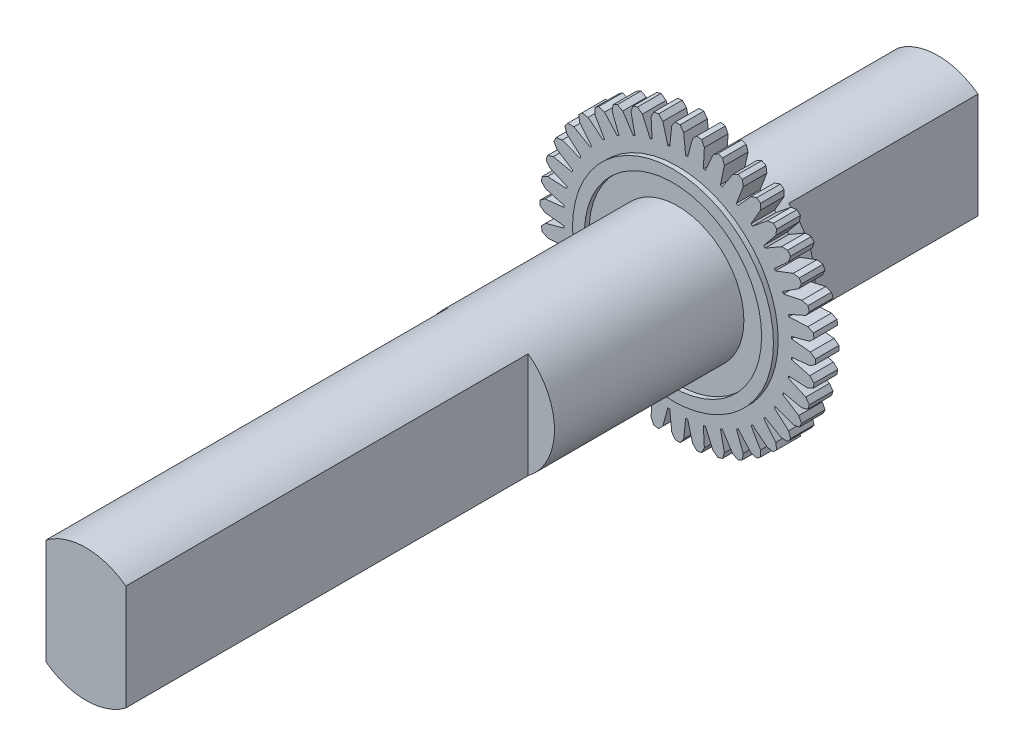
from build123d import *

# Parameters (mm, degrees)
BOSS_EXTRUDE1_DEPTH = 1
SKETCH2_R           = 4.245
SKETCH2_R_2         = 3.745
BOSS_EXTRUDE2_DEPTH = 0.2
SKETCH3_R           = 2.795
BOSS_EXTRUDE3_DEPTH = 25
BOSS_EXTRUDE4_START = 2
SKETCH4_R           = 2.795
BOSS_EXTRUDE4_DEPTH = 2
CUT_EXTRUDE2_DEPTH  = 17
BOSS_EXTRUDE5_START = 8
BOSS_EXTRUDE5_DEPTH = 8


with BuildPart() as part:
    # Sketch1 → Boss-Extrude1 (new body)
    with BuildSketch(Plane.XY):
        with BuildLine():
            Line((1.009764153, 5.726657084), (1.125066167, 5.495777362))
            Line((1.125066167, 5.495777362), (1.083139327, 4.691591862))
            ThreePointArc((1.083139327, 4.691591862), (1.124039427, 4.681961167), (1.164853927, 4.671973922))
            Line((1.164853927, 4.671973922), (1.492589417, 5.407542837))
            Line((1.492589417, 5.407542837), (1.700141463, 5.560912156))
            ThreePointArc((1.700141463, 5.560912156), (1.796933822, 5.530393642), (1.893178818, 5.498190517))
            Line((1.893178818, 5.498190517), (1.970943727, 5.2521161))
            Line((1.970943727, 5.2521161), (1.803730747, 4.46439026))
            ThreePointArc((1.803730747, 4.46439026), (1.842620727, 4.448479949), (1.881370384, 4.432230869))
            Line((1.881370384, 4.432230869), (2.320139235, 5.107474584))
            Line((2.320139235, 5.107474584), (2.549128219, 5.226487379))
            ThreePointArc((2.549128219, 5.226487379), (2.639954756, 5.181202938), (2.729977138, 5.134340252))
            Line((2.729977138, 5.134340252), (2.768290111, 4.879130307))
            Line((2.768290111, 4.879130307), (2.479908331, 4.127260553))
            ThreePointArc((2.479908331, 4.127260553), (2.515830589, 4.105462391), (2.551561257, 4.083351583))
            Line((2.551561257, 4.083351583), (3.090559525, 4.681643357))
            Line((3.090559525, 4.681643357), (3.335346977, 4.763369138))
            ThreePointArc((3.335346977, 4.763369138), (3.417971242, 4.704433822), (3.49955436, 4.644065491))
            Line((3.49955436, 4.644065491), (3.497472006, 4.386004134))
            Line((3.497472006, 4.386004134), (3.095022341, 3.688503994))
            ThreePointArc((3.095022341, 3.688503994), (3.127092353, 3.661354724), (3.158924225, 3.633926629))
            Line((3.158924225, 3.633926629), (3.784879983, 4.140534532))
            Line((3.784879983, 4.140534532), (4.039438424, 4.182960939))
            ThreePointArc((4.039438424, 4.182960939), (4.111825933, 4.111825933), (4.182960939, 4.039438424))
            Line((4.182960939, 4.039438424), (4.140534532, 3.784879983))
            Line((4.140534532, 3.784879983), (3.633926629, 3.158924225))
            ThreePointArc((3.633926629, 3.158924225), (3.661354724, 3.127092353), (3.688503994, 3.095022341))
            Line((3.688503994, 3.095022341), (4.386004134, 3.497472006))
            Line((4.386004134, 3.497472006), (4.644065491, 3.49955436))
            ThreePointArc((4.644065491, 3.49955436), (4.704433822, 3.417971242), (4.763369138, 3.335346977))
            Line((4.763369138, 3.335346977), (4.681643357, 3.090559525))
            Line((4.681643357, 3.090559525), (4.083351583, 2.551561257))
            ThreePointArc((4.083351583, 2.551561257), (4.105462391, 2.515830589), (4.127260553, 2.479908331))
            Line((4.127260553, 2.479908331), (4.879130307, 2.768290111))
            Line((4.879130307, 2.768290111), (5.134340252, 2.729977138))
            ThreePointArc((5.134340252, 2.729977138), (5.181202938, 2.639954756), (5.226487379, 2.549128219))
            Line((5.226487379, 2.549128219), (5.107474584, 2.320139235))
            Line((5.107474584, 2.320139235), (4.432230869, 1.881370384))
            ThreePointArc((4.432230869, 1.881370384), (4.448479949, 1.842620727), (4.46439026, 1.803730747))
            Line((4.46439026, 1.803730747), (5.2521161, 1.970943727))
            Line((5.2521161, 1.970943727), (5.498190517, 1.893178818))
            ThreePointArc((5.498190517, 1.893178818), (5.530393642, 1.796933822), (5.560912156, 1.700141463))
            Line((5.560912156, 1.700141463), (5.407542837, 1.492589417))
            Line((5.407542837, 1.492589417), (4.671973922, 1.164853927))
            ThreePointArc((4.671973922, 1.164853927), (4.681961167, 1.124039427), (4.691591862, 1.083139327))
            Line((4.691591862, 1.083139327), (5.495777362, 1.125066167))
            Line((5.495777362, 1.125066167), (5.726657084, 1.009764153))
            ThreePointArc((5.726657084, 1.009764153), (5.743407701, 0.909666414), (5.75840882, 0.809291582))
            Line((5.75840882, 0.809291582), (5.574459438, 0.628287093))
            Line((5.574459438, 0.628287093), (4.796677471, 0.419654901))
            ThreePointArc((4.796677471, 0.419654901), (4.800156962, 0.377780546), (4.803270902, 0.335877421))
            Line((4.803270902, 0.335877421), (5.604114347, 0.251485743))
            Line((5.604114347, 0.251485743), (5.814114347, 0.101485743))
            ThreePointArc((5.814114347, 0.101485743), (5.815, 0), (5.814114347, -0.101485743))
            Line((5.814114347, -0.101485743), (5.604114347, -0.251485743))
            Line((5.604114347, -0.251485743), (4.803270902, -0.335877421))
            ThreePointArc((4.803270902, -0.335877421), (4.800156962, -0.377780546), (4.796677471, -0.419654901))
            Line((4.796677471, -0.419654901), (5.574459438, -0.628287093))
            Line((5.574459438, -0.628287093), (5.75840882, -0.809291582))
            ThreePointArc((5.75840882, -0.809291582), (5.743407701, -0.909666414), (5.726657084, -1.009764153))
            Line((5.726657084, -1.009764153), (5.495777362, -1.125066167))
            Line((5.495777362, -1.125066167), (4.691591862, -1.083139327))
            ThreePointArc((4.691591862, -1.083139327), (4.681961167, -1.124039427), (4.671973922, -1.164853927))
            Line((4.671973922, -1.164853927), (5.407542837, -1.492589417))
            Line((5.407542837, -1.492589417), (5.560912156, -1.700141463))
            ThreePointArc((5.560912156, -1.700141463), (5.530393642, -1.796933822), (5.498190517, -1.893178818))
            Line((5.498190517, -1.893178818), (5.2521161, -1.970943727))
            Line((5.2521161, -1.970943727), (4.46439026, -1.803730747))
            ThreePointArc((4.46439026, -1.803730747), (4.448479949, -1.842620727), (4.432230869, -1.881370384))
            Line((4.432230869, -1.881370384), (5.107474584, -2.320139235))
            Line((5.107474584, -2.320139235), (5.226487379, -2.549128219))
            ThreePointArc((5.226487379, -2.549128219), (5.181202938, -2.639954756), (5.134340252, -2.729977138))
            Line((5.134340252, -2.729977138), (4.879130307, -2.768290111))
            Line((4.879130307, -2.768290111), (4.127260553, -2.479908331))
            ThreePointArc((4.127260553, -2.479908331), (4.105462391, -2.515830589), (4.083351583, -2.551561257))
            Line((4.083351583, -2.551561257), (4.681643357, -3.090559525))
            Line((4.681643357, -3.090559525), (4.763369138, -3.335346977))
            ThreePointArc((4.763369138, -3.335346977), (4.704433822, -3.417971242), (4.644065491, -3.49955436))
            Line((4.644065491, -3.49955436), (4.386004134, -3.497472006))
            Line((4.386004134, -3.497472006), (3.688503994, -3.095022341))
            ThreePointArc((3.688503994, -3.095022341), (3.661354724, -3.127092353), (3.633926629, -3.158924225))
            Line((3.633926629, -3.158924225), (4.140534532, -3.784879983))
            Line((4.140534532, -3.784879983), (4.182960939, -4.039438424))
            ThreePointArc((4.182960939, -4.039438424), (4.111825933, -4.111825933), (4.039438424, -4.182960939))
            Line((4.039438424, -4.182960939), (3.784879983, -4.140534532))
            Line((3.784879983, -4.140534532), (3.158924225, -3.633926629))
            ThreePointArc((3.158924225, -3.633926629), (3.127092353, -3.661354724), (3.095022341, -3.688503994))
            Line((3.095022341, -3.688503994), (3.497472006, -4.386004134))
            Line((3.497472006, -4.386004134), (3.49955436, -4.644065491))
            ThreePointArc((3.49955436, -4.644065491), (3.417971242, -4.704433822), (3.335346977, -4.763369138))
            Line((3.335346977, -4.763369138), (3.090559525, -4.681643357))
            Line((3.090559525, -4.681643357), (2.551561257, -4.083351583))
            ThreePointArc((2.551561257, -4.083351583), (2.515830589, -4.105462391), (2.479908331, -4.127260553))
            Line((2.479908331, -4.127260553), (2.768290111, -4.879130307))
            Line((2.768290111, -4.879130307), (2.729977138, -5.134340252))
            ThreePointArc((2.729977138, -5.134340252), (2.639954756, -5.181202938), (2.549128219, -5.226487379))
            Line((2.549128219, -5.226487379), (2.320139235, -5.107474584))
            Line((2.320139235, -5.107474584), (1.881370384, -4.432230869))
            ThreePointArc((1.881370384, -4.432230869), (1.842620727, -4.448479949), (1.803730747, -4.46439026))
            Line((1.803730747, -4.46439026), (1.970943727, -5.2521161))
            Line((1.970943727, -5.2521161), (1.893178818, -5.498190517))
            ThreePointArc((1.893178818, -5.498190517), (1.796933822, -5.530393642), (1.700141463, -5.560912156))
            Line((1.700141463, -5.560912156), (1.492589417, -5.407542837))
            Line((1.492589417, -5.407542837), (1.164853927, -4.671973922))
            ThreePointArc((1.164853927, -4.671973922), (1.124039427, -4.681961167), (1.083139327, -4.691591862))
            Line((1.083139327, -4.691591862), (1.125066167, -5.495777362))
            Line((1.125066167, -5.495777362), (1.009764153, -5.726657084))
            ThreePointArc((1.009764153, -5.726657084), (0.909666414, -5.743407701), (0.809291582, -5.75840882))
            Line((0.809291582, -5.75840882), (0.628287093, -5.574459438))
            Line((0.628287093, -5.574459438), (0.419654901, -4.796677471))
            ThreePointArc((0.419654901, -4.796677471), (0.377780546, -4.800156962), (0.335877421, -4.803270902))
            Line((0.335877421, -4.803270902), (0.251485743, -5.604114347))
            Line((0.251485743, -5.604114347), (0.101485743, -5.814114347))
            ThreePointArc((0.101485743, -5.814114347), (0, -5.815), (-0.101485743, -5.814114347))
            Line((-0.101485743, -5.814114347), (-0.251485743, -5.604114347))
            Line((-0.251485743, -5.604114347), (-0.335877421, -4.803270902))
            ThreePointArc((-0.335877421, -4.803270902), (-0.377780546, -4.800156962), (-0.419654901, -4.796677471))
            Line((-0.419654901, -4.796677471), (-0.628287093, -5.574459438))
            Line((-0.628287093, -5.574459438), (-0.809291582, -5.75840882))
            ThreePointArc((-0.809291582, -5.75840882), (-0.909666414, -5.743407701), (-1.009764153, -5.726657084))
            Line((-1.009764153, -5.726657084), (-1.125066167, -5.495777362))
            Line((-1.125066167, -5.495777362), (-1.083139327, -4.691591862))
            ThreePointArc((-1.083139327, -4.691591862), (-1.124039427, -4.681961167), (-1.164853927, -4.671973922))
            Line((-1.164853927, -4.671973922), (-1.492589417, -5.407542837))
            Line((-1.492589417, -5.407542837), (-1.700141463, -5.560912156))
            ThreePointArc((-1.700141463, -5.560912156), (-1.796933822, -5.530393642), (-1.893178818, -5.498190517))
            Line((-1.893178818, -5.498190517), (-1.970943727, -5.2521161))
            Line((-1.970943727, -5.2521161), (-1.803730747, -4.46439026))
            ThreePointArc((-1.803730747, -4.46439026), (-1.842620727, -4.448479949), (-1.881370384, -4.432230869))
            Line((-1.881370384, -4.432230869), (-2.320139235, -5.107474584))
            Line((-2.320139235, -5.107474584), (-2.549128219, -5.226487379))
            ThreePointArc((-2.549128219, -5.226487379), (-2.639954756, -5.181202938), (-2.729977138, -5.134340252))
            Line((-2.729977138, -5.134340252), (-2.768290111, -4.879130307))
            Line((-2.768290111, -4.879130307), (-2.479908331, -4.127260553))
            ThreePointArc((-2.479908331, -4.127260553), (-2.515830589, -4.105462391), (-2.551561257, -4.083351583))
            Line((-2.551561257, -4.083351583), (-3.090559525, -4.681643357))
            Line((-3.090559525, -4.681643357), (-3.335346977, -4.763369138))
            ThreePointArc((-3.335346977, -4.763369138), (-3.417971242, -4.704433822), (-3.49955436, -4.644065491))
            Line((-3.49955436, -4.644065491), (-3.497472006, -4.386004134))
            Line((-3.497472006, -4.386004134), (-3.095022341, -3.688503994))
            ThreePointArc((-3.095022341, -3.688503994), (-3.127092353, -3.661354724), (-3.158924225, -3.633926629))
            Line((-3.158924225, -3.633926629), (-3.784879983, -4.140534532))
            Line((-3.784879983, -4.140534532), (-4.039438424, -4.182960939))
            ThreePointArc((-4.039438424, -4.182960939), (-4.111825933, -4.111825933), (-4.182960939, -4.039438424))
            Line((-4.182960939, -4.039438424), (-4.140534532, -3.784879983))
            Line((-4.140534532, -3.784879983), (-3.633926629, -3.158924225))
            ThreePointArc((-3.633926629, -3.158924225), (-3.661354724, -3.127092353), (-3.688503994, -3.095022341))
            Line((-3.688503994, -3.095022341), (-4.386004134, -3.497472006))
            Line((-4.386004134, -3.497472006), (-4.644065491, -3.49955436))
            ThreePointArc((-4.644065491, -3.49955436), (-4.704433822, -3.417971242), (-4.763369138, -3.335346977))
            Line((-4.763369138, -3.335346977), (-4.681643357, -3.090559525))
            Line((-4.681643357, -3.090559525), (-4.083351583, -2.551561257))
            ThreePointArc((-4.083351583, -2.551561257), (-4.105462391, -2.515830589), (-4.127260553, -2.479908331))
            Line((-4.127260553, -2.479908331), (-4.879130307, -2.768290111))
            Line((-4.879130307, -2.768290111), (-5.134340252, -2.729977138))
            ThreePointArc((-5.134340252, -2.729977138), (-5.181202938, -2.639954756), (-5.226487379, -2.549128219))
            Line((-5.226487379, -2.549128219), (-5.107474584, -2.320139235))
            Line((-5.107474584, -2.320139235), (-4.432230869, -1.881370384))
            ThreePointArc((-4.432230869, -1.881370384), (-4.448479949, -1.842620727), (-4.46439026, -1.803730747))
            Line((-4.46439026, -1.803730747), (-5.2521161, -1.970943727))
            Line((-5.2521161, -1.970943727), (-5.498190517, -1.893178818))
            ThreePointArc((-5.498190517, -1.893178818), (-5.530393642, -1.796933822), (-5.560912156, -1.700141463))
            Line((-5.560912156, -1.700141463), (-5.407542837, -1.492589417))
            Line((-5.407542837, -1.492589417), (-4.671973922, -1.164853927))
            ThreePointArc((-4.671973922, -1.164853927), (-4.681961167, -1.124039427), (-4.691591862, -1.083139327))
            Line((-4.691591862, -1.083139327), (-5.495777362, -1.125066167))
            Line((-5.495777362, -1.125066167), (-5.726657084, -1.009764153))
            ThreePointArc((-5.726657084, -1.009764153), (-5.743407701, -0.909666414), (-5.75840882, -0.809291582))
            Line((-5.75840882, -0.809291582), (-5.574459438, -0.628287093))
            Line((-5.574459438, -0.628287093), (-4.796677471, -0.419654901))
            ThreePointArc((-4.796677471, -0.419654901), (-4.800156962, -0.377780546), (-4.803270902, -0.335877421))
            Line((-4.803270902, -0.335877421), (-5.604114347, -0.251485743))
            Line((-5.604114347, -0.251485743), (-5.814114347, -0.101485743))
            ThreePointArc((-5.814114347, -0.101485743), (-5.815, 0), (-5.814114347, 0.101485743))
            Line((-5.814114347, 0.101485743), (-5.604114347, 0.251485743))
            Line((-5.604114347, 0.251485743), (-4.803270902, 0.335877421))
            ThreePointArc((-4.803270902, 0.335877421), (-4.800156962, 0.377780546), (-4.796677471, 0.419654901))
            Line((-4.796677471, 0.419654901), (-5.574459438, 0.628287093))
            Line((-5.574459438, 0.628287093), (-5.75840882, 0.809291582))
            ThreePointArc((-5.75840882, 0.809291582), (-5.743407701, 0.909666414), (-5.726657084, 1.009764153))
            Line((-5.726657084, 1.009764153), (-5.495777362, 1.125066167))
            Line((-5.495777362, 1.125066167), (-4.691591862, 1.083139327))
            ThreePointArc((-4.691591862, 1.083139327), (-4.681961167, 1.124039427), (-4.671973922, 1.164853927))
            Line((-4.671973922, 1.164853927), (-5.407542837, 1.492589417))
            Line((-5.407542837, 1.492589417), (-5.560912156, 1.700141463))
            ThreePointArc((-5.560912156, 1.700141463), (-5.530393642, 1.796933822), (-5.498190517, 1.893178818))
            Line((-5.498190517, 1.893178818), (-5.2521161, 1.970943727))
            Line((-5.2521161, 1.970943727), (-4.46439026, 1.803730747))
            ThreePointArc((-4.46439026, 1.803730747), (-4.448479949, 1.842620727), (-4.432230869, 1.881370384))
            Line((-4.432230869, 1.881370384), (-5.107474584, 2.320139235))
            Line((-5.107474584, 2.320139235), (-5.226487379, 2.549128219))
            ThreePointArc((-5.226487379, 2.549128219), (-5.181202938, 2.639954756), (-5.134340252, 2.729977138))
            Line((-5.134340252, 2.729977138), (-4.879130307, 2.768290111))
            Line((-4.879130307, 2.768290111), (-4.127260553, 2.479908331))
            ThreePointArc((-4.127260553, 2.479908331), (-4.105462391, 2.515830589), (-4.083351583, 2.551561257))
            Line((-4.083351583, 2.551561257), (-4.681643357, 3.090559525))
            Line((-4.681643357, 3.090559525), (-4.763369138, 3.335346977))
            ThreePointArc((-4.763369138, 3.335346977), (-4.704433822, 3.417971242), (-4.644065491, 3.49955436))
            Line((-4.644065491, 3.49955436), (-4.386004134, 3.497472006))
            Line((-4.386004134, 3.497472006), (-3.688503994, 3.095022341))
            ThreePointArc((-3.688503994, 3.095022341), (-3.661354724, 3.127092353), (-3.633926629, 3.158924225))
            Line((-3.633926629, 3.158924225), (-4.140534532, 3.784879983))
            Line((-4.140534532, 3.784879983), (-4.182960939, 4.039438424))
            ThreePointArc((-4.182960939, 4.039438424), (-4.111825933, 4.111825933), (-4.039438424, 4.182960939))
            Line((-4.039438424, 4.182960939), (-3.784879983, 4.140534532))
            Line((-3.784879983, 4.140534532), (-3.158924225, 3.633926629))
            ThreePointArc((-3.158924225, 3.633926629), (-3.127092353, 3.661354724), (-3.095022341, 3.688503994))
            Line((-3.095022341, 3.688503994), (-3.497472006, 4.386004134))
            Line((-3.497472006, 4.386004134), (-3.49955436, 4.644065491))
            ThreePointArc((-3.49955436, 4.644065491), (-3.417971242, 4.704433822), (-3.335346977, 4.763369138))
            Line((-3.335346977, 4.763369138), (-3.090559525, 4.681643357))
            Line((-3.090559525, 4.681643357), (-2.551561257, 4.083351583))
            ThreePointArc((-2.551561257, 4.083351583), (-2.515830589, 4.105462391), (-2.479908331, 4.127260553))
            Line((-2.479908331, 4.127260553), (-2.768290111, 4.879130307))
            Line((-2.768290111, 4.879130307), (-2.729977138, 5.134340252))
            ThreePointArc((-2.729977138, 5.134340252), (-2.639954756, 5.181202938), (-2.549128219, 5.226487379))
            Line((-2.549128219, 5.226487379), (-2.320139235, 5.107474584))
            Line((-2.320139235, 5.107474584), (-1.881370384, 4.432230869))
            ThreePointArc((-1.881370384, 4.432230869), (-1.842620727, 4.448479949), (-1.803730747, 4.46439026))
            Line((-1.803730747, 4.46439026), (-1.970943727, 5.2521161))
            Line((-1.970943727, 5.2521161), (-1.893178818, 5.498190517))
            ThreePointArc((-1.893178818, 5.498190517), (-1.796933822, 5.530393642), (-1.700141463, 5.560912156))
            Line((-1.700141463, 5.560912156), (-1.492589417, 5.407542837))
            Line((-1.492589417, 5.407542837), (-1.164853927, 4.671973922))
            ThreePointArc((-1.164853927, 4.671973922), (-1.124039427, 4.681961167), (-1.083139327, 4.691591862))
            Line((-1.083139327, 4.691591862), (-1.125066167, 5.495777362))
            Line((-1.125066167, 5.495777362), (-1.009764153, 5.726657084))
            ThreePointArc((-1.009764153, 5.726657084), (-0.909666414, 5.743407701), (-0.809291582, 5.75840882))
            Line((-0.809291582, 5.75840882), (-0.628287093, 5.574459438))
            Line((-0.628287093, 5.574459438), (-0.419654901, 4.796677471))
            ThreePointArc((-0.419654901, 4.796677471), (-0.377780546, 4.800156962), (-0.335877421, 4.803270902))
            Line((-0.335877421, 4.803270902), (-0.251485743, 5.604114347))
            Line((-0.251485743, 5.604114347), (-0.101485743, 5.814114347))
            ThreePointArc((-0.101485743, 5.814114347), (0, 5.815), (0.101485743, 5.814114347))
            Line((0.101485743, 5.814114347), (0.251485743, 5.604114347))
            Line((0.251485743, 5.604114347), (0.335877421, 4.803270902))
            ThreePointArc((0.335877421, 4.803270902), (0.377780546, 4.800156962), (0.419654901, 4.796677471))
            Line((0.419654901, 4.796677471), (0.628287093, 5.574459438))
            Line((0.628287093, 5.574459438), (0.809291582, 5.75840882))
            ThreePointArc((0.809291582, 5.75840882), (0.909666414, 5.743407701), (1.009764153, 5.726657084))
        make_face()
    extrude(amount=BOSS_EXTRUDE1_DEPTH)

    # Sketch2 → Boss-Extrude2 (add)
    with BuildSketch(Plane.XY.offset(1)):
        Circle(SKETCH2_R)
        Circle(SKETCH2_R_2, mode=Mode.SUBTRACT)
    extrude(amount=BOSS_EXTRUDE2_DEPTH)

    # Sketch3 → Boss-Extrude3 (add)
    with BuildSketch(Plane.XY.offset(1)):
        Circle(SKETCH3_R)
    extrude(amount=BOSS_EXTRUDE3_DEPTH)

    # Sketch4 → Boss-Extrude4 (add)
    with BuildSketch(Plane(origin=(0, 0, 0), x_dir=(-1, 0, 0), z_dir=(0, 0, -1)).offset(BOSS_EXTRUDE4_START)):
        with Locations(Location((0, 0, 0), (0, 0, 180))):
            Circle(SKETCH4_R)
    extrude(amount=-BOSS_EXTRUDE4_DEPTH)

    # Sketch6 → Cut-Extrude2 (cut)
    with BuildSketch(Plane.XY.offset(26)):
        Polygon((-1.685, 2.795), (-3.330985664, 0.713949615), (-3.089298788, -1.200954095), (-1.685, -2.795), align=None)
        Polygon((1.685, -2.795), (1.685, 2.795), (3.518332732, 0.713949615), (3.213151287, -0.959267219), align=None)
    extrude(amount=-CUT_EXTRUDE2_DEPTH, mode=Mode.SUBTRACT)

    # Sketch7 → Boss-Extrude5 (add)
    with BuildSketch(Plane(origin=(0, 0, -2), x_dir=(-1, 0, 0), z_dir=(0, 0, -1)).offset(BOSS_EXTRUDE5_START)):
        with BuildLine():
            Line((1.685, -2.229977578), (1.685, 2.229977578))
            ThreePointArc((1.685, 2.229977578), (0, 2.795), (-1.685, 2.229977578))
            Line((-1.685, 2.229977578), (-1.685, -2.229977578))
            ThreePointArc((-1.685, -2.229977578), (0, -2.795), (1.685, -2.229977578))
        make_face()
    extrude(amount=-BOSS_EXTRUDE5_DEPTH)


solid = part.part
